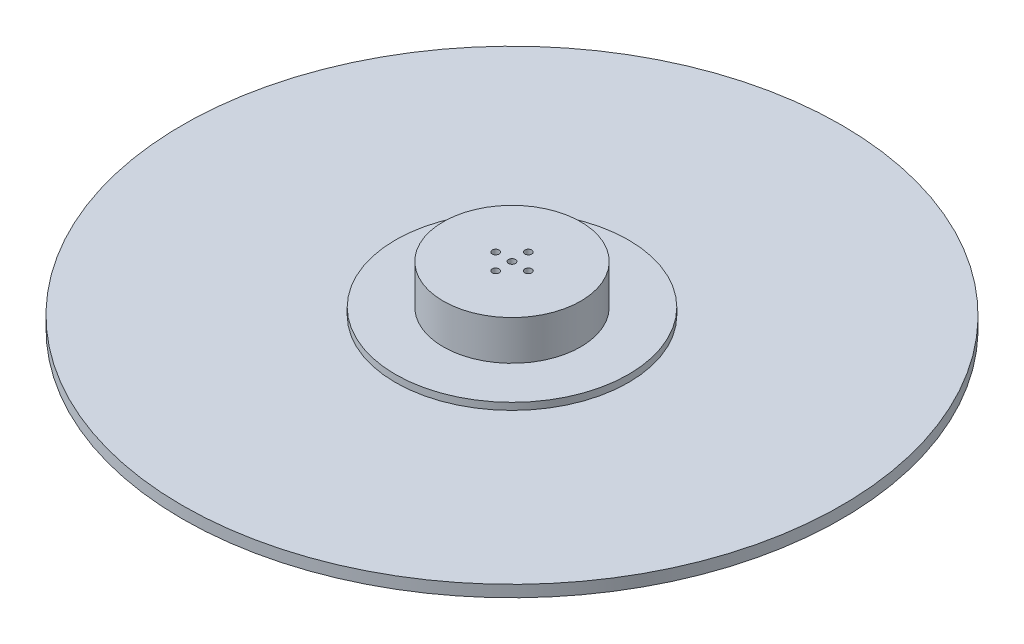
from build123d import *

# Parameters (mm, degrees)
SKETCH_1_R          = 141.4
EXTRUDE_1_DEPTH     = 5
SKETCH_2_R          = 50
EXTRUDE_2_DEPTH     = 3
SKETCH_3_R          = 29.5
EXTRUDE_3_DEPTH     = 17
SKETCH_4_R          = 27
CUT_EXTRUDE_1_DEPTH = 22
SKETCH_5_R          = 1.5
CUT_EXTRUDE_2_DEPTH = 202.176340557


with BuildPart() as part:
    # 草图1 → 凸台-拉伸1 (new body)
    with BuildSketch(Plane(origin=(0, 0, 0), x_dir=(1, 0, 0), z_dir=(0, 1, 0))):
        with Locations(Location((0, 0, 0), (0, 0, 270))):
            Circle(SKETCH_1_R)
    extrude(amount=EXTRUDE_1_DEPTH)

    # 草图2 → 凸台-拉伸2 (add)
    with BuildSketch(Plane(origin=(0, 5, 0), x_dir=(1, 0, 0), z_dir=(0, 1, 0))):
        with Locations(Location((0, 0, 0), (0, 0, 270))):
            Circle(SKETCH_2_R)
    extrude(amount=EXTRUDE_2_DEPTH)

    # 草图3 → 凸台-拉伸3 (add)
    with BuildSketch(Plane(origin=(0, 8, 0), x_dir=(1, 0, 0), z_dir=(0, 1, 0))):
        with Locations(Location((0, 0, 0), (0, 0, 270))):
            Circle(SKETCH_3_R)
    extrude(amount=EXTRUDE_3_DEPTH)

    # 草图4 → 切除-拉伸1 (cut)
    with BuildSketch(Plane.XZ):
        with Locations(Location((0, 0, 0), (0, 0, 270))):
            Circle(SKETCH_4_R)
    extrude(amount=-CUT_EXTRUDE_1_DEPTH, mode=Mode.SUBTRACT)

    # 草图5 → 切除-拉伸2 (cut, through all)
    with BuildSketch(Plane.XZ.offset(-22)):
        with Locations(Location((0, 0, 0), (0, 0, 270))):
            Circle(SKETCH_5_R)
        with Locations(Location((0, 7, 0), (0, 0, 270))):
            Circle(SKETCH_5_R)
        with Locations(Location((7, 0, 0), (0, 0, 270))):
            Circle(SKETCH_5_R)
        with Locations(Location((0, -7, 0), (0, 0, 270))):
            Circle(SKETCH_5_R)
        with Locations(Location((-7, 0, 0), (0, 0, 270))):
            Circle(SKETCH_5_R)
    extrude(amount=-CUT_EXTRUDE_2_DEPTH, mode=Mode.SUBTRACT)


solid = part.part
